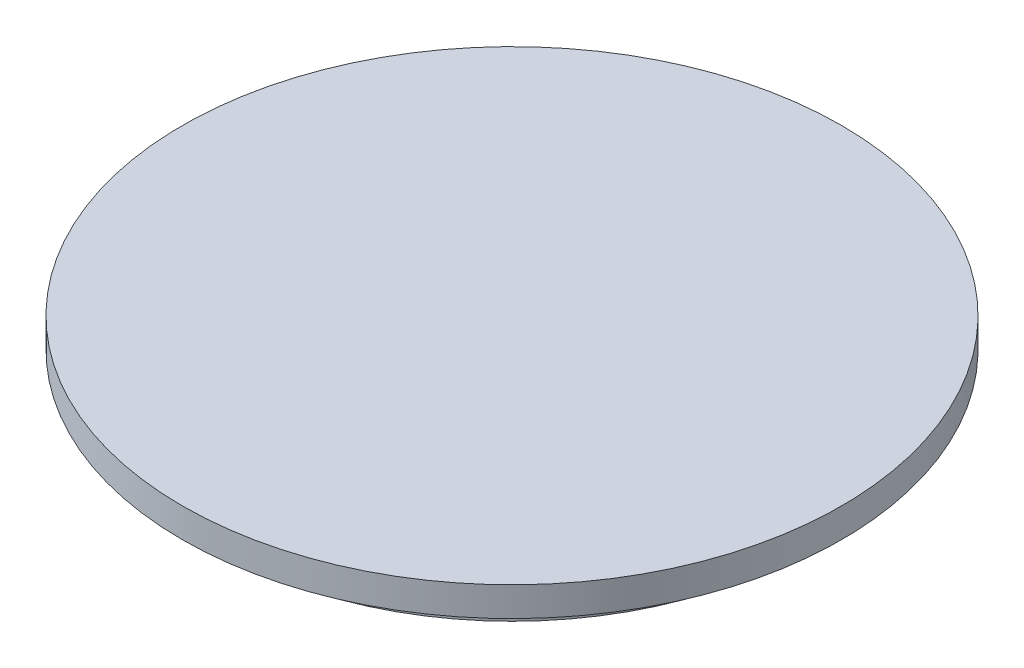
from build123d import *

# Parameters (mm, degrees)
SKIZZE1_R                       = 22.5
AUFSATZ_LINEAR_AUSTRAGEN1_DEPTH = 2
SKIZZE2_R                       = 19.9
SKIZZE2_R_2                     = 17.9
AUFSATZ_LINEAR_AUSTRAGEN2_DEPTH = 2


with BuildPart() as part:
    # Skizze1 → Aufsatz-Linear austragen1 (new body)
    with BuildSketch(Plane(origin=(0, 0, 0), x_dir=(1, 0, 0), z_dir=(0, 1, 0))):
        with Locations(Location((0, 0, 0), (0, 0, 270))):
            Circle(SKIZZE1_R)
    extrude(amount=AUFSATZ_LINEAR_AUSTRAGEN1_DEPTH)

    # Skizze2 → Aufsatz-Linear austragen2 (add)
    with BuildSketch(Plane(origin=(0, 0, 0), x_dir=(1, 0, 0), z_dir=(0, 1, 0))):
        with Locations(Location((0, 0, 0), (0, 0, 270))):
            Circle(SKIZZE2_R)
        with Locations(Location((0, 0, 0), (0, 0, 270))):
            Circle(SKIZZE2_R_2, mode=Mode.SUBTRACT)
    extrude(amount=-AUFSATZ_LINEAR_AUSTRAGEN2_DEPTH)


solid = part.part
